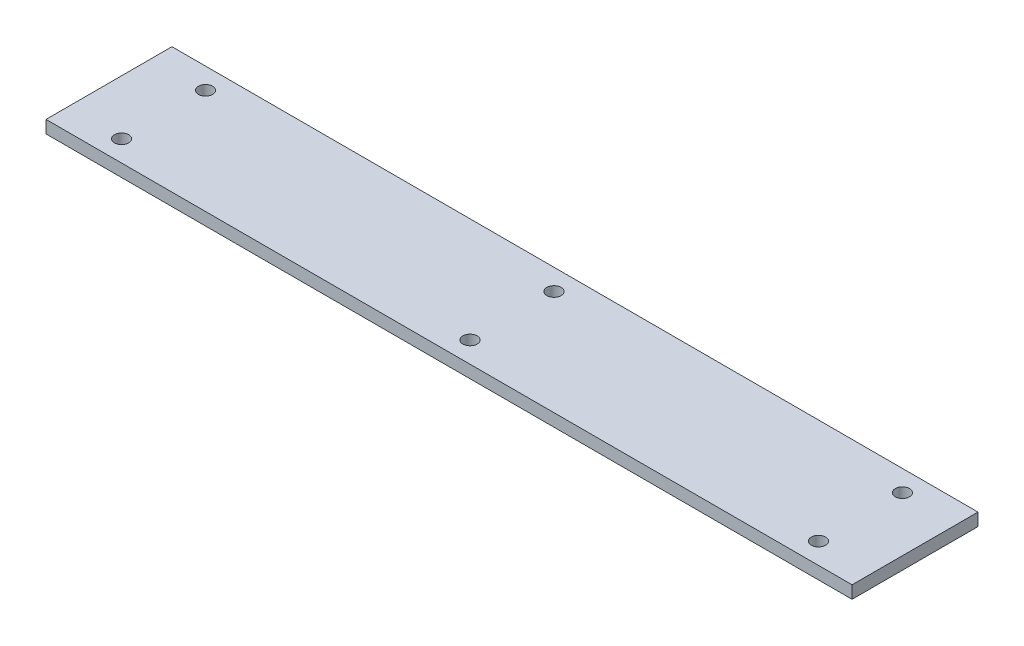
from build123d import *

# Parameters (mm, degrees)
SKETCH1_W           = 192
SKETCH1_H           = 30
SKETCH1_R           = 1.7
BOSS_EXTRUDE1_DEPTH = 3


with BuildPart() as part:
    # Sketch1 → Boss-Extrude1 (new body)
    with BuildSketch(Plane(origin=(0, 0, 0), x_dir=(1, 0, 0), z_dir=(0, 1, 0))):
        with Locations((96, 15)):
            Rectangle(SKETCH1_W, SKETCH1_H)
        with Locations(Location((13, 25, 0), (0, 0, 270))):
            Circle(SKETCH1_R, mode=Mode.SUBTRACT)
        with Locations(Location((13, 5, 0), (0, 0, 270))):
            Circle(SKETCH1_R, mode=Mode.SUBTRACT)
        with Locations(Location((96, 25, 0), (0, 0, 270))):
            Circle(SKETCH1_R, mode=Mode.SUBTRACT)
        with Locations(Location((96, 5, 0), (0, 0, 270))):
            Circle(SKETCH1_R, mode=Mode.SUBTRACT)
        with Locations(Location((179, 25, 0), (0, 0, 270))):
            Circle(SKETCH1_R, mode=Mode.SUBTRACT)
        with Locations(Location((179, 5, 0), (0, 0, 270))):
            Circle(SKETCH1_R, mode=Mode.SUBTRACT)
    extrude(amount=BOSS_EXTRUDE1_DEPTH)


solid = part.part
